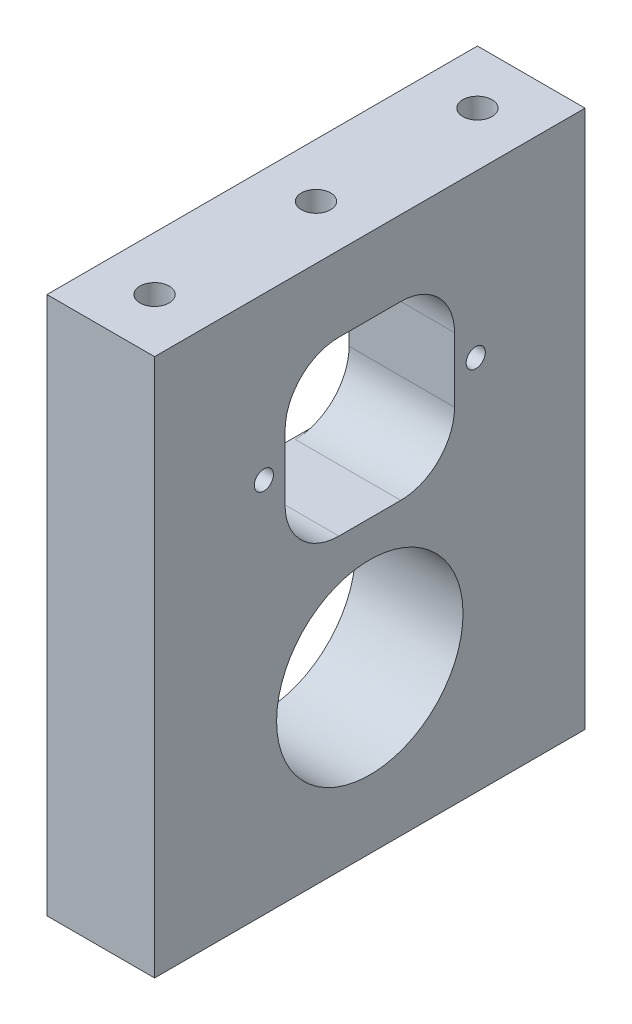
from build123d import *

# Parameters (mm, degrees)
SKETCH1_W                  = 50.8
SKETCH1_H                  = 63.5
BOSS_EXTRUDE1_DEPTH        = 12.7
F_22_0_22_DIAMETER_HOLE1_D = 22
F_4_40_TAPPED_HOLE1_D      = 2.2606
CUT_EXTRUDE1_DEPTH         = 43.597094971
CUT_EXTRUDE2_DEPTH         = 0.254
F_8_32_TAPPED_HOLE1_D      = 3.4544
F_8_32_TAPPED_HOLE1_DEPTH  = 10.668
F_8_32_TAPPED_HOLE1_TIP    = 1.037806461


with BuildPart() as part:
    # Sketch1 → Boss-Extrude1 (new body)
    with BuildSketch(Plane(origin=(0, 0, 0), x_dir=(0, 0, -1), z_dir=(1, 0, 0))):
        Rectangle(SKETCH1_W, SKETCH1_H)
    extrude(amount=BOSS_EXTRUDE1_DEPTH)

    # Ø22.0 (22) Diameter Hole1 (through all)
    with Locations(Plane(origin=(12.7, 0, 0), x_dir=(0, 0, -1), z_dir=(1, 0, 0))):
        with Locations((0, -12.7)):
            Hole(F_22_0_22_DIAMETER_HOLE1_D / 2)

    # Sketch4 → 1/16 NPT Tapped Hole1 (revolve, cut)
    with BuildSketch(Plane.ZX.offset(12.7)):
        Polygon((0, 0), (0, 13.530685027), (3.0734, 11.684), (3.0734, 6.858), (3.762574096, 6.858), (3.9679118, 0), align=None)
    revolve(axis=Axis((-6.35, 12.7, 0), (1, 0, 0)), mode=Mode.SUBTRACT)

    # #4-40 Tapped Hole1 (through all)
    with Locations(Plane(origin=(12.7, 0, 0), x_dir=(0, 0, -1), z_dir=(1, 0, 0))):
        with Locations((-12.5, 12.7), (12.5, 12.7)):
            Hole(F_4_40_TAPPED_HOLE1_D / 2)

    # Sketch9 → Cut-Extrude1 (cut, through all)
    with BuildSketch(Plane(origin=(12.7, 0, 0), x_dir=(0, 0, -1), z_dir=(1, 0, 0))):
        with BuildLine():
            Line((-3.65, 2.54), (3.65, 2.54))
            ThreePointArc((3.65, 2.54), (8.140128061, 4.399871939), (10, 8.89))
            Line((10, 8.89), (10, 16.51))
            ThreePointArc((10, 16.51), (8.140128061, 21.000128061), (3.65, 22.86))
            Line((3.65, 22.86), (-3.65, 22.86))
            ThreePointArc((-3.65, 22.86), (-8.140128061, 21.000128061), (-10, 16.51))
            Line((-10, 16.51), (-10, 8.89))
            ThreePointArc((-10, 8.89), (-8.140128061, 4.399871939), (-3.65, 2.54))
        make_face()
    extrude(amount=-CUT_EXTRUDE1_DEPTH, mode=Mode.SUBTRACT)

    # Sketch10 → Cut-Extrude2 (cut)
    with BuildSketch(Plane(origin=(0, 0, 0), x_dir=(0, 0, -1), z_dir=(1, 0, 0))):
        with BuildLine():
            Line((-12.5, 2.54), (12.5, 2.54))
            ThreePointArc((12.5, 2.54), (16.990128061, 4.399871939), (18.85, 8.89))
            Line((18.85, 8.89), (18.85, 16.51))
            ThreePointArc((18.85, 16.51), (16.990128061, 21.000128061), (12.5, 22.86))
            Line((12.5, 22.86), (-12.5, 22.86))
            ThreePointArc((-12.5, 22.86), (-16.990128061, 21.000128061), (-18.85, 16.51))
            Line((-18.85, 16.51), (-18.85, 8.89))
            ThreePointArc((-18.85, 8.89), (-16.990128061, 4.399871939), (-12.5, 2.54))
        make_face()
    extrude(amount=CUT_EXTRUDE2_DEPTH, mode=Mode.SUBTRACT)

    # #8-32 Tapped Hole1
    with Locations(Plane(origin=(0, 31.75, 0), x_dir=(1, 0, 0), z_dir=(0, 1, 0))):
        with Locations((6.35, 19.05), (6.35, -19.05), (6.35, 0)):
            Hole(F_8_32_TAPPED_HOLE1_D / 2, depth=F_8_32_TAPPED_HOLE1_DEPTH)
            with Locations((0, 0, -(F_8_32_TAPPED_HOLE1_DEPTH + F_8_32_TAPPED_HOLE1_TIP / 2))):  # 118° drill point
                Cone(0, F_8_32_TAPPED_HOLE1_D / 2, F_8_32_TAPPED_HOLE1_TIP, mode=Mode.SUBTRACT)


solid = part.part
